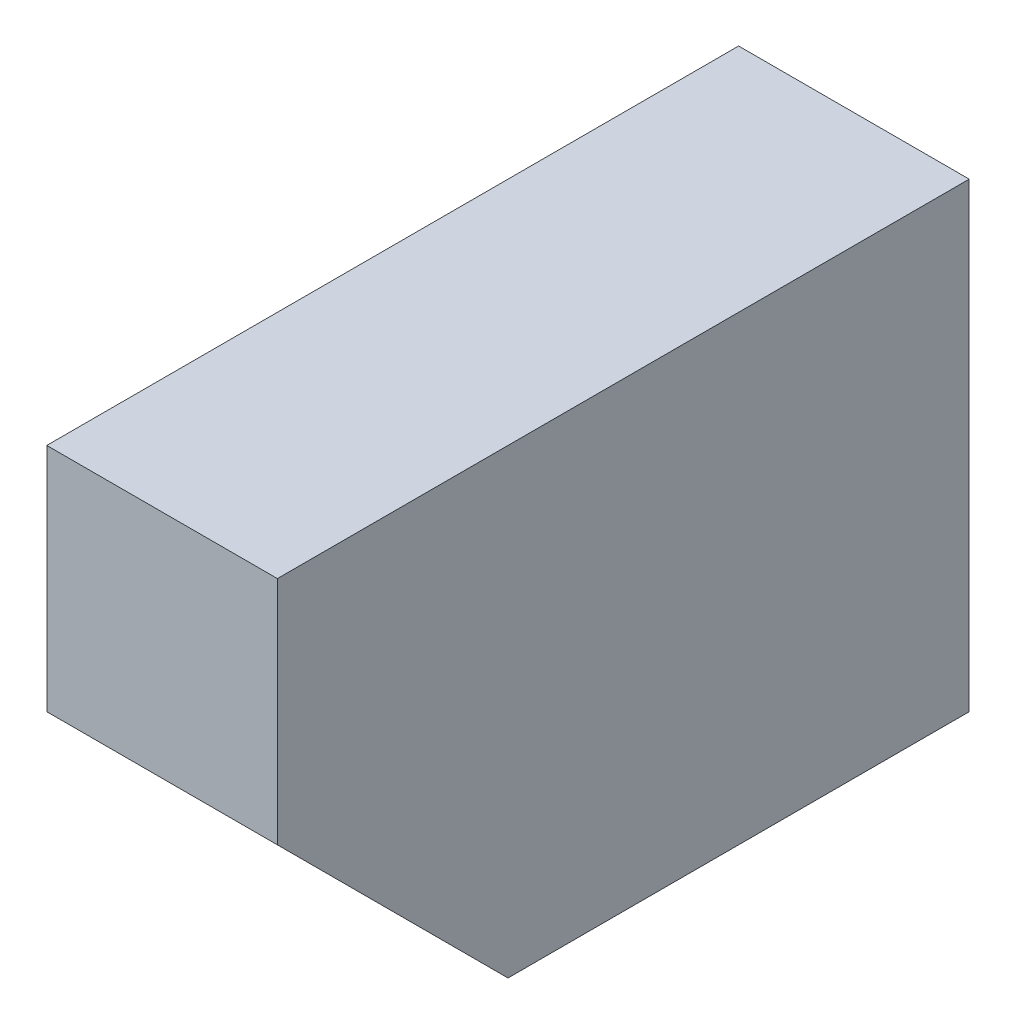
from build123d import *

# Parameters (mm, degrees)
SKETCH2_W           = 50
SKETCH2_H           = 100
BOSS_EXTRUDE1_DEPTH = 150
CUT_EXTRUDE1_DEPTH  = 150


with BuildPart() as part:
    # Sketch2 → Boss-Extrude1 (new body)
    with BuildSketch(Plane.XY):
        Rectangle(SKETCH2_W, SKETCH2_H)
    extrude(amount=BOSS_EXTRUDE1_DEPTH)

    # Sketch3 → Cut-Extrude1 (cut)
    with BuildSketch(Plane.ZY.offset(25)):
        Polygon((150, 0), (100, -50), (150, -50), align=None)
    extrude(amount=-CUT_EXTRUDE1_DEPTH, mode=Mode.SUBTRACT)


solid = part.part
